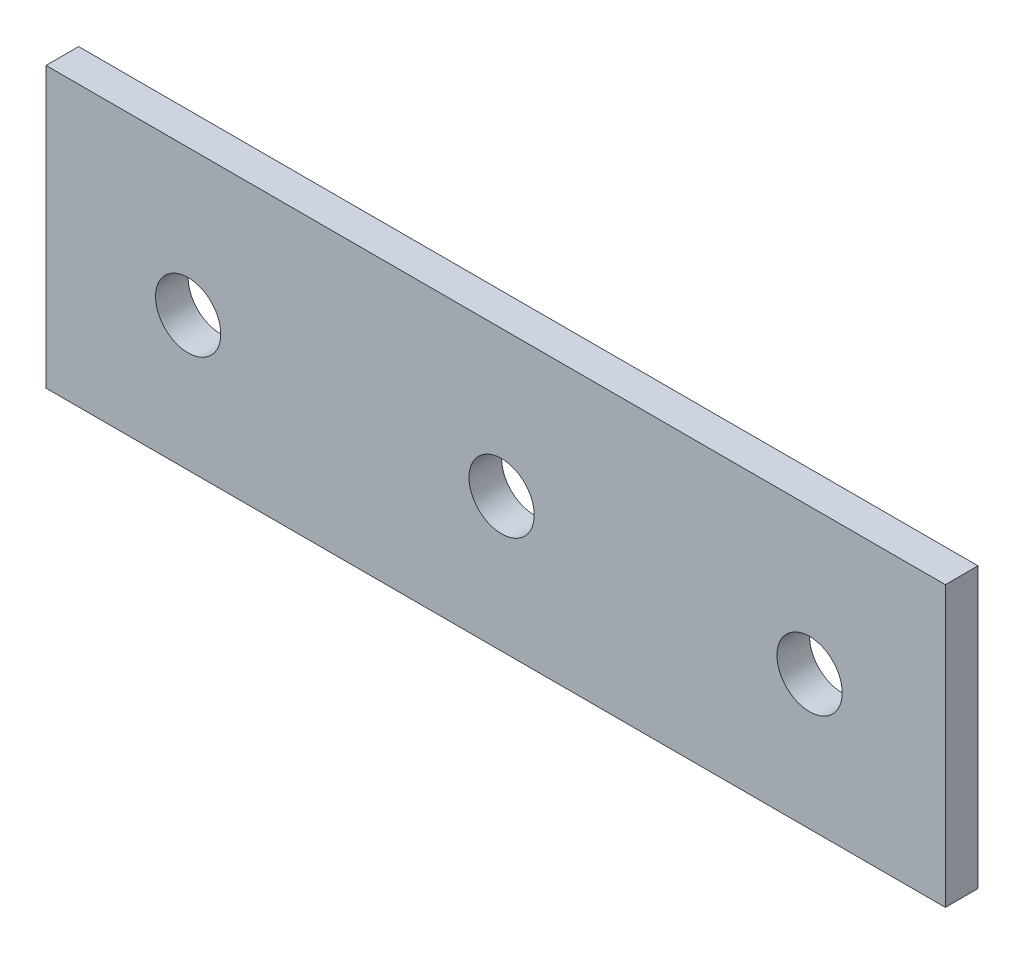
from build123d import *

# Parameters (mm, degrees)
SKETCH1_W           = 275.580198982
SKETCH1_H           = 85.650035504
SKETCH1_R           = 10
BOSS_EXTRUDE1_DEPTH = 10


with BuildPart() as part:
    # Sketch1 → Boss-Extrude1 (new body)
    with BuildSketch(Plane.XY):
        with Locations((36.171413299, 10.766741751)):
            Rectangle(SKETCH1_W, SKETCH1_H)
        with Locations((-58.067820681, 9.073096981)):
            Circle(SKETCH1_R, mode=Mode.SUBTRACT)
        with Locations((37.986032695, 9.073096981)):
            Circle(SKETCH1_R, mode=Mode.SUBTRACT)
        with Locations((132.346241302, 9.073096981)):
            Circle(SKETCH1_R, mode=Mode.SUBTRACT)
    extrude(amount=BOSS_EXTRUDE1_DEPTH)


solid = part.part
